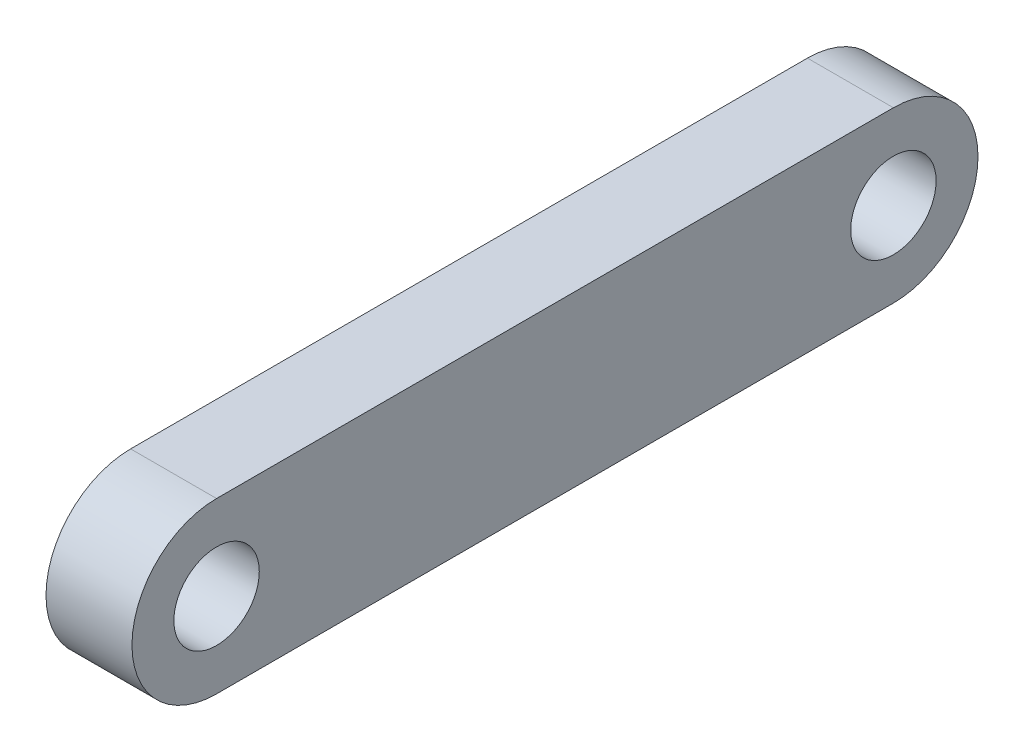
from build123d import *

# Parameters (mm, degrees)
SKETCH1_R           = 2.0193
BOSS_EXTRUDE1_DEPTH = 4.064


with BuildPart() as part:
    # Sketch1 → Boss-Extrude1 (new body)
    with BuildSketch(Plane(origin=(0, 0, 0), x_dir=(0, 0, -1), z_dir=(1, 0, 0))):
        with BuildLine():
            Line((0, 4), (32, 4))
            ThreePointArc((32, 4), (36, 0), (32, -4))
            Line((32, -4), (0, -4))
            ThreePointArc((0, -4), (-4, 0), (0, 4))
        make_face()
        Circle(SKETCH1_R, mode=Mode.SUBTRACT)
        with Locations((32, 0)):
            Circle(SKETCH1_R, mode=Mode.SUBTRACT)
    extrude(amount=BOSS_EXTRUDE1_DEPTH)


solid = part.part
